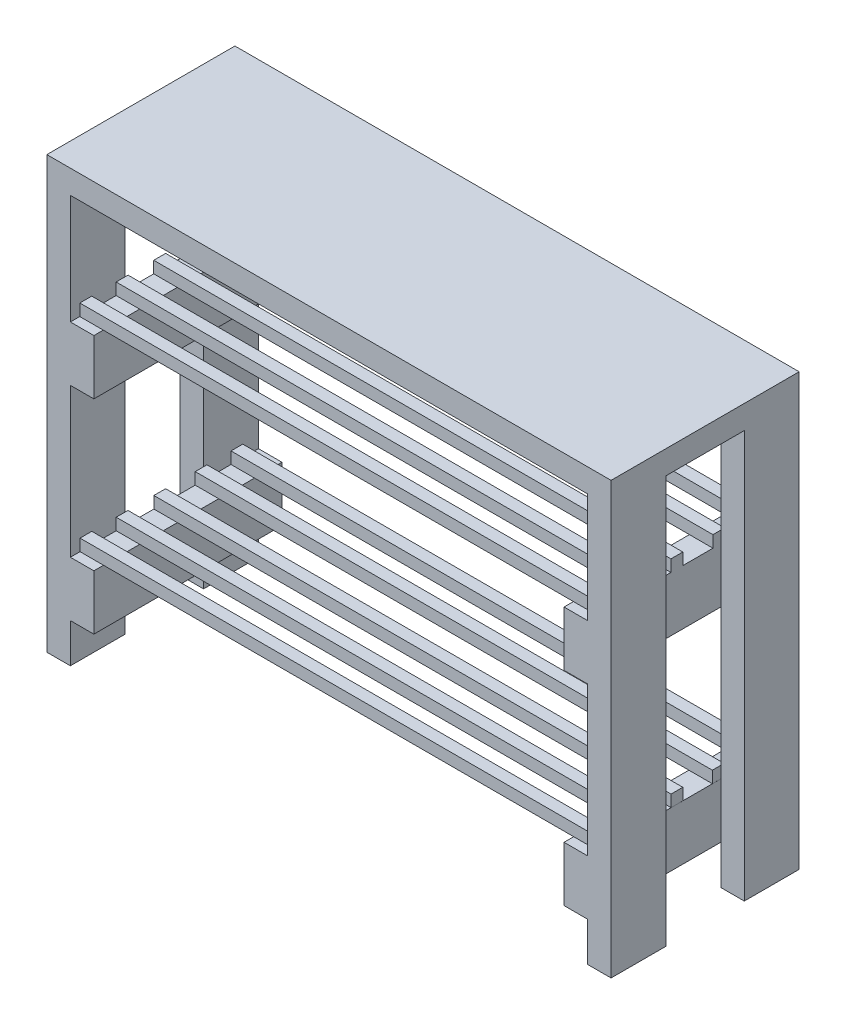
from build123d import *

# Parameters (mm, degrees)
SKETCH1_W            = 914.4
SKETCH1_H            = 304.8
BOSS_EXTRUDE3_DEPTH  = 38.1
SKETCH5_W            = 38.1
SKETCH5_H            = 88.9
BOSS_EXTRUDE4_DEPTH  = 660.4
SKETCH7_W            = 304.8
SKETCH7_H            = 88.9
BOSS_EXTRUDE5_DEPTH  = 38.1
SKETCH6_W            = 304.8
SKETCH6_H            = 88.9
BOSS_EXTRUDE6_DEPTH  = 38.1
SKETCH9_W            = 304.8
SKETCH9_H            = 88.9
BOSS_EXTRUDE7_DEPTH  = 38.1
SKETCH8_W            = 304.8
SKETCH8_H            = 88.9
BOSS_EXTRUDE8_DEPTH  = 38.1
SKETCH10_W           = 838.2
SKETCH10_H           = 19.05
SKETCH10_W_2         = 838.173774045
SKETCH10_W_3         = 838.158204612
SKETCH10_W_4         = 838.175626617
SKETCH10_W_5         = 838.17389523
BOSS_EXTRUDE9_DEPTH  = 19.05
SKETCH11_W           = 838.2
SKETCH11_H           = 19.05
SKETCH11_H_2         = 19.304
BOSS_EXTRUDE10_DEPTH = 19.05


with BuildPart() as part:
    # Sketch1 → Boss-Extrude3 (new body)
    with BuildSketch(Plane(origin=(0, 0, 0), x_dir=(1, 0, 0), z_dir=(0, 1, 0))):
        with Locations((457.2, 152.4)):
            Rectangle(SKETCH1_W, SKETCH1_H)
    extrude(amount=BOSS_EXTRUDE3_DEPTH)

    # Sketch5 → Boss-Extrude4 (add)
    with BuildSketch(Plane.XZ):
        with Locations((19.05, -44.45)):
            Rectangle(SKETCH5_W, SKETCH5_H)
        with Locations((19.05, -260.35)):
            Rectangle(SKETCH5_W, SKETCH5_H)
        with Locations((895.35, -44.45)):
            Rectangle(SKETCH5_W, SKETCH5_H)
        with Locations((895.35, -260.35)):
            Rectangle(SKETCH5_W, SKETCH5_H)
    extrude(amount=BOSS_EXTRUDE4_DEPTH)

    # Sketch7 → Boss-Extrude5 (add)
    with BuildSketch(Plane(origin=(38.1, 0, 0), x_dir=(0, 0, -1), z_dir=(1, 0, 0))):
        with Locations((152.4, -222.25)):
            Rectangle(SKETCH7_W, SKETCH7_H)
    extrude(amount=BOSS_EXTRUDE5_DEPTH)

    # Sketch6 → Boss-Extrude6 (add)
    with BuildSketch(Plane.ZY.offset(-876.3)):
        with Locations((-152.4, -222.25)):
            Rectangle(SKETCH6_W, SKETCH6_H)
    extrude(amount=BOSS_EXTRUDE6_DEPTH)

    # Sketch9 → Boss-Extrude7 (add)
    with BuildSketch(Plane.ZY.offset(-876.3)):
        with Locations((-152.4, -552.45)):
            Rectangle(SKETCH9_W, SKETCH9_H)
    extrude(amount=BOSS_EXTRUDE7_DEPTH)

    # Sketch8 → Boss-Extrude8 (add)
    with BuildSketch(Plane(origin=(38.1, 0, 0), x_dir=(0, 0, -1), z_dir=(1, 0, 0))):
        with Locations((152.4, -552.45)):
            Rectangle(SKETCH8_W, SKETCH8_H)
    extrude(amount=BOSS_EXTRUDE8_DEPTH)

    # Sketch10 → Boss-Extrude9 (add)
    with BuildSketch(Plane(origin=(0, -508, 0), x_dir=(1, 0, 0), z_dir=(0, 1, 0))):
        with Locations((457.2, 269.875)):
            Rectangle(SKETCH10_W, SKETCH10_H)
        with Locations((457.180463347, 211.855946701)):
            Rectangle(SKETCH10_W_2, SKETCH10_H)
        with Locations((457.188248064, 144.838690295)):
            Rectangle(SKETCH10_W_3, SKETCH10_H)
        with Locations((457.155340061, 83.805117496)):
            Rectangle(SKETCH10_W_4, SKETCH10_H)
        with Locations((457.213052385, 25.16501814)):
            Rectangle(SKETCH10_W_5, SKETCH10_H)
    extrude(amount=BOSS_EXTRUDE9_DEPTH)

    # Sketch11 → Boss-Extrude10 (add)
    with BuildSketch(Plane(origin=(0, -177.8, 0), x_dir=(1, 0, 0), z_dir=(0, 1, 0))):
        with Locations((457.2, 269.875)):
            Rectangle(SKETCH11_W, SKETCH11_H)
        with Locations((457.2, 212.725)):
            Rectangle(SKETCH11_W, SKETCH11_H)
        with Locations((457.2, 144.78)):
            Rectangle(SKETCH11_W, SKETCH11_H_2)
        with Locations((457.2, 83.841878729)):
            Rectangle(SKETCH11_W, SKETCH11_H_2)
        with Locations((457.283867399, 24.910423168)):
            Rectangle(SKETCH11_W, SKETCH11_H_2)
    extrude(amount=BOSS_EXTRUDE10_DEPTH)


solid = part.part
